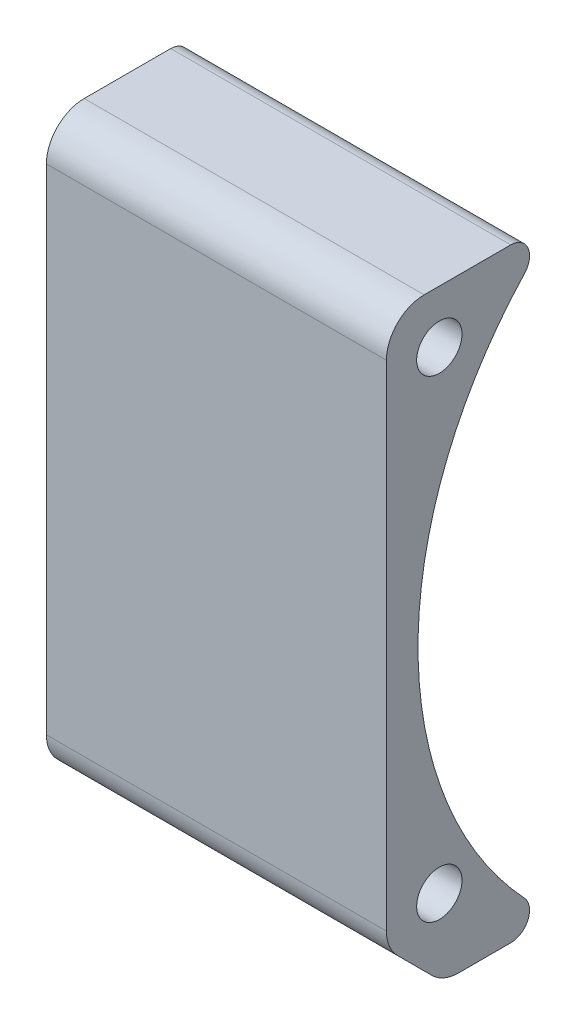
from build123d import *

# Parameters (mm, degrees)
BOSS_EXTRUDE1_DEPTH   = 28.575
CHAMFER1_SIZE         = 4.7625
FILLET1_R             = 3.175
FILLET2_R             = 1.5875
F_8_CLEARANCE_HOLE1_D = 3.81


with BuildPart() as part:
    # Sketch1 → Boss-Extrude1 (new body)
    with BuildSketch(Plane(origin=(0, 0, 0), x_dir=(0, 0, -1), z_dir=(1, 0, 0))):
        with BuildLine():
            Line((0, 0), (0, 50.8))
            Line((0, 50.8), (14.399754562, 50.8))
            ThreePointArc((14.399754562, 50.8), (2.654588994, 25.4), (14.399754562, 0))
            Line((14.399754562, 0), (0, 0))
        make_face()
    extrude(amount=BOSS_EXTRUDE1_DEPTH)

    # Chamfer1
    chamfer1_edges = [part.edges().sort_by_distance(p)[0] for p in [
        (14.2875, 0, 0),
    ]]
    chamfer(chamfer1_edges, length=CHAMFER1_SIZE)

    # Fillet1
    fillet1_edges = [part.edges().sort_by_distance(p)[0] for p in [
        (14.2875, 0, -4.7625),
        (14.2875, 4.7625, 0),
        (14.2875, 50.8, 0),
    ]]
    fillet(fillet1_edges, radius=FILLET1_R)

    # Fillet2
    fillet2_edges = [part.edges().sort_by_distance(p)[0] for p in [
        (14.2875, 50.8, -14.399754562),
        (14.2875, 0, -14.399754562),
    ]]
    fillet(fillet2_edges, radius=FILLET2_R)

    # #8 Clearance Hole1 (through all)
    with Locations(Plane(origin=(28.575, 0, 0), x_dir=(0, 0, -1), z_dir=(1, 0, 0))):
        with Locations((4.445, 46.355), (4.445, 6.603679285)):
            Hole(F_8_CLEARANCE_HOLE1_D / 2)


solid = part.part
